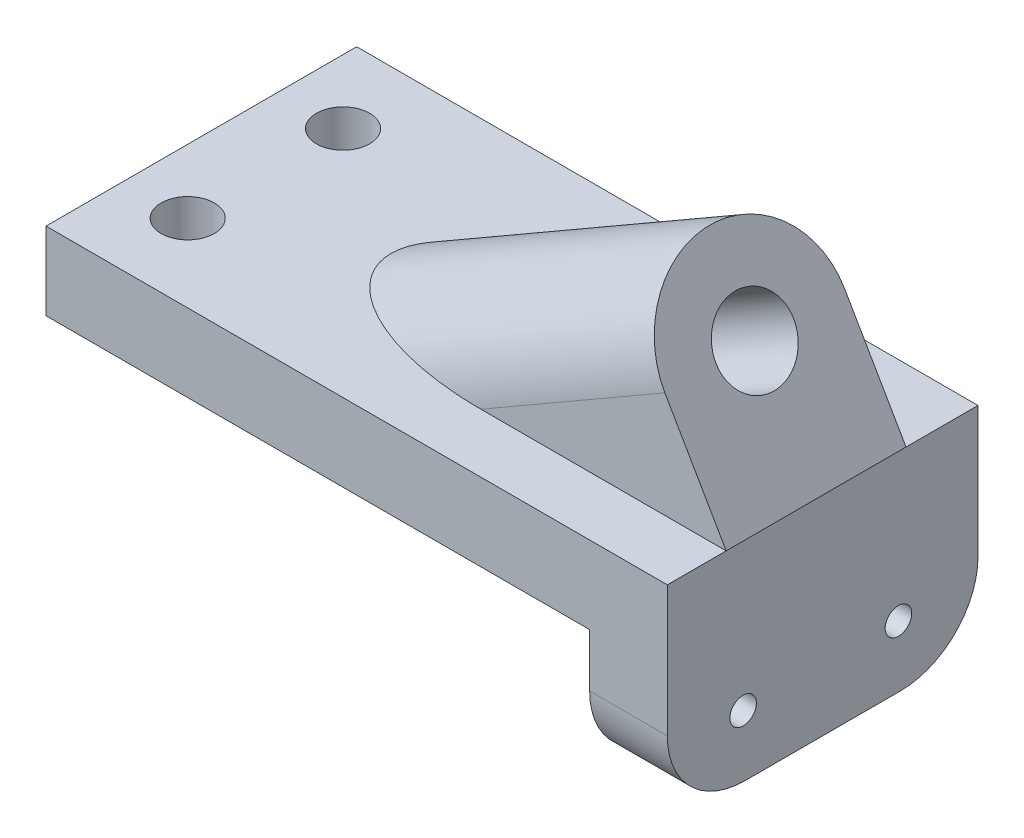
from build123d import *

# Parameters (mm, degrees)
EXTRUDE_1_DEPTH     = 76
EXTRUDE_2_REACH     = 182.051
SKETCH_2_R          = 9.5
SKETCH_3_R          = 3.25
CUT_EXTRUDE_1_DEPTH = 76
SKETCH_4_R          = 6.5
CUT_EXTRUDE_2_DEPTH = 76
FILLET_2_R          = 19


with BuildPart() as part:
    # 스케치1 → 보스-돌출1 (new body)
    with BuildSketch(Plane.XY):
        Polygon((0, 0), (152, 0), (152, -51), (133, -51), (133, -19), (0, -19), align=None)
    extrude(amount=EXTRUDE_1_DEPTH)

    # 보스-돌출2: up to this face of the body (flat: up to its plane)
    extrude_2_end = Plane(part.part.faces().sort_by_distance((76, 0, 38))[0])
    # 스케치2 → 보스-돌출2 (add, up to the picked face)
    with BuildSketch(Plane(origin=(114, 65.817930688, 0), x_dir=(0, 0, -1), z_dir=(0.8660254037844398, 0.499999999999998, 0)), mode=Mode.PRIVATE) as extrude_2_sk1:
        with BuildLine():
            Line((-61.604391893, -46), (-61.604391893, -76))
            Line((-61.604391893, -76), (-17.604391893, -76))
            Line((-17.604391893, -76), (-17.604391893, -46))
            ThreePointArc((-17.604391893, -46), (-39.604391893, -24), (-61.604391893, -46))
        make_face()
        with Locations(Location((-39.604391893, -46, 0), (0, 0, 90))):
            Circle(SKETCH_2_R, mode=Mode.SUBTRACT)
    extrude_2_tool1 = split(extrude(extrude_2_sk1.sketch, amount=-EXTRUDE_2_REACH, mode=Mode.PRIVATE), bisect_by=extrude_2_end, keep=Keep.BOTH, mode=Mode.PRIVATE)
    add(extrude_2_tool1.solids().sort_by(Axis((144.5, 12.990381, 60.923216), (-0.8660254037844398, -0.499999999999998, 0)))[0])

    # 스케치3 → 컷-돌출1 (cut)
    with BuildSketch(Plane(origin=(152, 0, 0), x_dir=(0, 0, -1), z_dir=(1, 0, 0))):
        with Locations((-57.45899172, -35.913585608)):
            Circle(SKETCH_3_R)
        with Locations((-19.45899172, -35.913585608)):
            Circle(SKETCH_3_R)
    extrude(amount=-CUT_EXTRUDE_1_DEPTH, mode=Mode.SUBTRACT)

    # 스케치4 → 컷-돌출2 (cut)
    with BuildSketch(Plane(origin=(0, 0, 0), x_dir=(1, 0, 0), z_dir=(0, 1, 0))):
        with Locations(Location((15.665320211, -57, 0), (0, 0, 270))):
            Circle(SKETCH_4_R)
        with Locations(Location((15.665320211, -19, 0), (0, 0, 270))):
            Circle(SKETCH_4_R)
    extrude(amount=-CUT_EXTRUDE_2_DEPTH, mode=Mode.SUBTRACT)

    # 필렛2
    fillet_2_edges = [part.edges().sort_by_distance(p)[0] for p in [
        (142.5, -51, 76),
        (142.5, -51, 0),
    ]]
    fillet(fillet_2_edges, radius=FILLET_2_R)


solid = part.part
